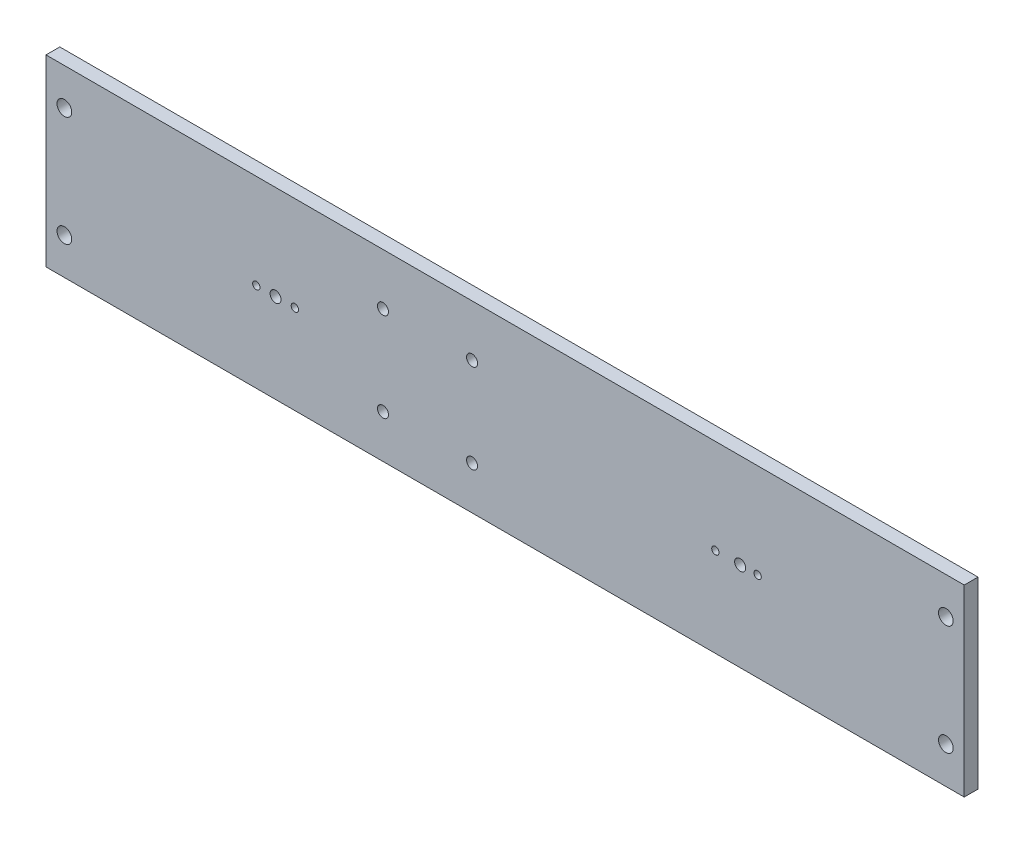
from build123d import *

# Parameters (mm, degrees)
SKETCH2_W           = 500
SKETCH2_H           = 100
BOSS_EXTRUDE1_DEPTH = 7.5
SKETCH8_R           = 3
CUT_EXTRUDE2_DEPTH  = 510.957106039
SKETCH9_R           = 3
SKETCH9_R_2         = 2
CUT_EXTRUDE3_DEPTH  = 510.957106039
SKETCH11_R          = 4
CUT_EXTRUDE4_DEPTH  = 510.957106039


with BuildPart() as part:
    # Sketch2 → Boss-Extrude1 (new body)
    with BuildSketch(Plane.XY):
        with Locations((250, 50)):
            Rectangle(SKETCH2_W, SKETCH2_H)
    extrude(amount=BOSS_EXTRUDE1_DEPTH)

    # Sketch8 → Cut-Extrude2 (cut, through all)
    with BuildSketch(Plane.XY.offset(7.5)):
        with Locations((183.5, 23.5)):
            Circle(SKETCH8_R)
        with Locations((183.5, 72)):
            Circle(SKETCH8_R)
        with Locations((232, 72)):
            Circle(SKETCH8_R)
        with Locations((232, 23.5)):
            Circle(SKETCH8_R)
    extrude(amount=-CUT_EXTRUDE2_DEPTH, mode=Mode.SUBTRACT)

    # Sketch9 → Cut-Extrude3 (cut, through all)
    with BuildSketch(Plane.XY.offset(7.5)):
        with Locations((125, 48.5)):
            Circle(SKETCH9_R)
        with Locations((135.5, 48.5)):
            Circle(SKETCH9_R_2)
        with Locations((114.5, 48.5)):
            Circle(SKETCH9_R_2)
        with Locations((378, 48.5)):
            Circle(SKETCH9_R)
        with Locations((387.5, 48.5)):
            Circle(SKETCH9_R_2)
        with Locations((364.5, 48.5)):
            Circle(SKETCH9_R_2)
    extrude(amount=-CUT_EXTRUDE3_DEPTH, mode=Mode.SUBTRACT)

    # Sketch11 → Cut-Extrude4 (cut, through all)
    with BuildSketch(Plane.XY.offset(7.5)):
        with Locations((10, 80)):
            Circle(SKETCH11_R)
        with Locations((10, 20)):
            Circle(SKETCH11_R)
        with Locations((490, 20)):
            Circle(SKETCH11_R)
        with Locations((490, 80)):
            Circle(SKETCH11_R)
    extrude(amount=-CUT_EXTRUDE4_DEPTH, mode=Mode.SUBTRACT)


solid = part.part
